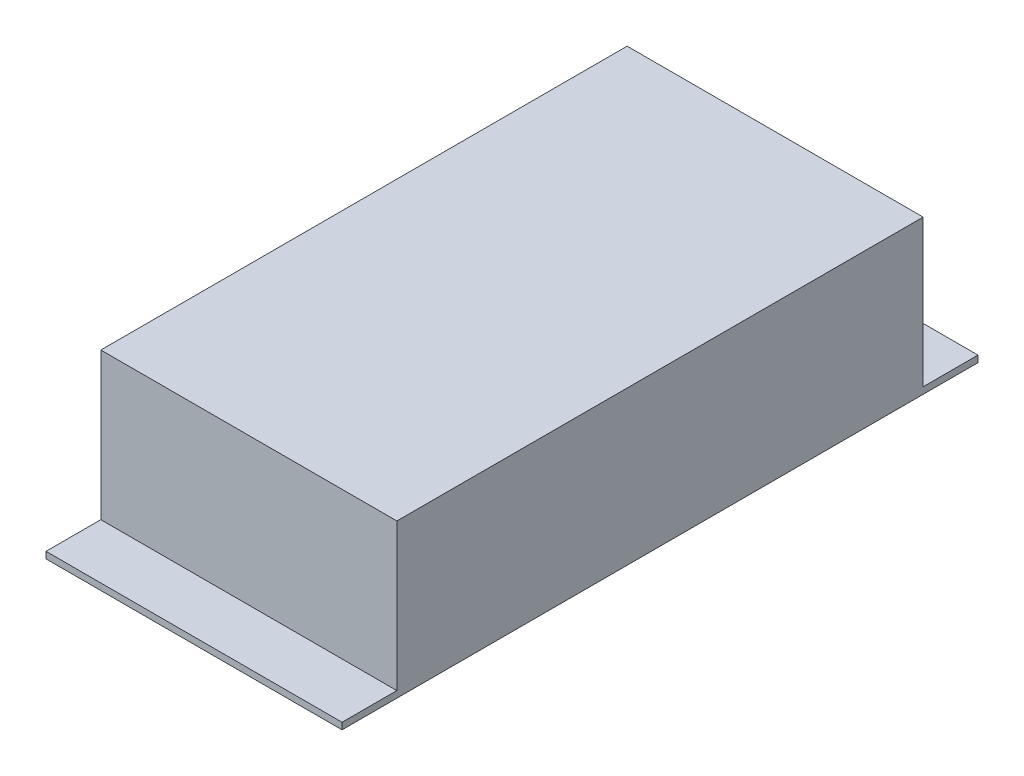
from build123d import *

# Parameters (mm, degrees)
SKETCH2_W           = 135
SKETCH2_H           = 290
BOSS_EXTRUDE1_DEPTH = 70
SKETCH4_W           = 135
SKETCH4_H           = 25
CUT_EXTRUDE1_DEPTH  = 67


with BuildPart() as part:
    # Sketch2 → Boss-Extrude1 (new body)
    with BuildSketch(Plane(origin=(0, 0, 0), x_dir=(1, 0, 0), z_dir=(0, 1, 0))):
        Rectangle(SKETCH2_W, SKETCH2_H)
    extrude(amount=BOSS_EXTRUDE1_DEPTH)

    # Sketch4 → Cut-Extrude1 (cut)
    with BuildSketch(Plane(origin=(0, 70, 0), x_dir=(1, 0, 0), z_dir=(0, 1, 0))):
        with Locations((0, -132.5)):
            Rectangle(SKETCH4_W, SKETCH4_H)
        with Locations((0, 132.5)):
            Rectangle(SKETCH4_W, SKETCH4_H)
    extrude(amount=-CUT_EXTRUDE1_DEPTH, mode=Mode.SUBTRACT)


solid = part.part
